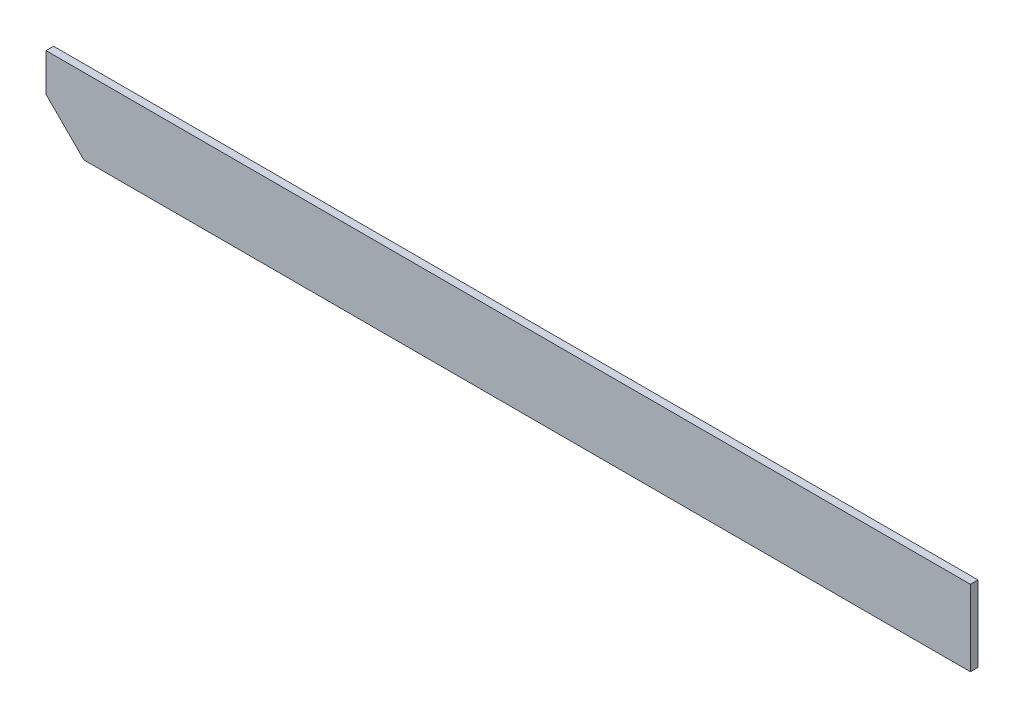
from build123d import *

# Parameters (mm, degrees)
SKETCH_1_W      = 1220
SKETCH_1_H      = 100
EXTRUDE_1_DEPTH = 10
CHAMFER_1_SIZE  = 50


with BuildPart() as part:
    # 草图1 → 凸台-拉伸1 (new body)
    with BuildSketch(Plane.XY):
        Rectangle(SKETCH_1_W, SKETCH_1_H)
    extrude(amount=EXTRUDE_1_DEPTH)

    # 倒角1
    chamfer_1_edges = [part.edges().sort_by_distance(p)[0] for p in [
        (-610, -50, 5),
    ]]
    chamfer(chamfer_1_edges, length=CHAMFER_1_SIZE)


solid = part.part
